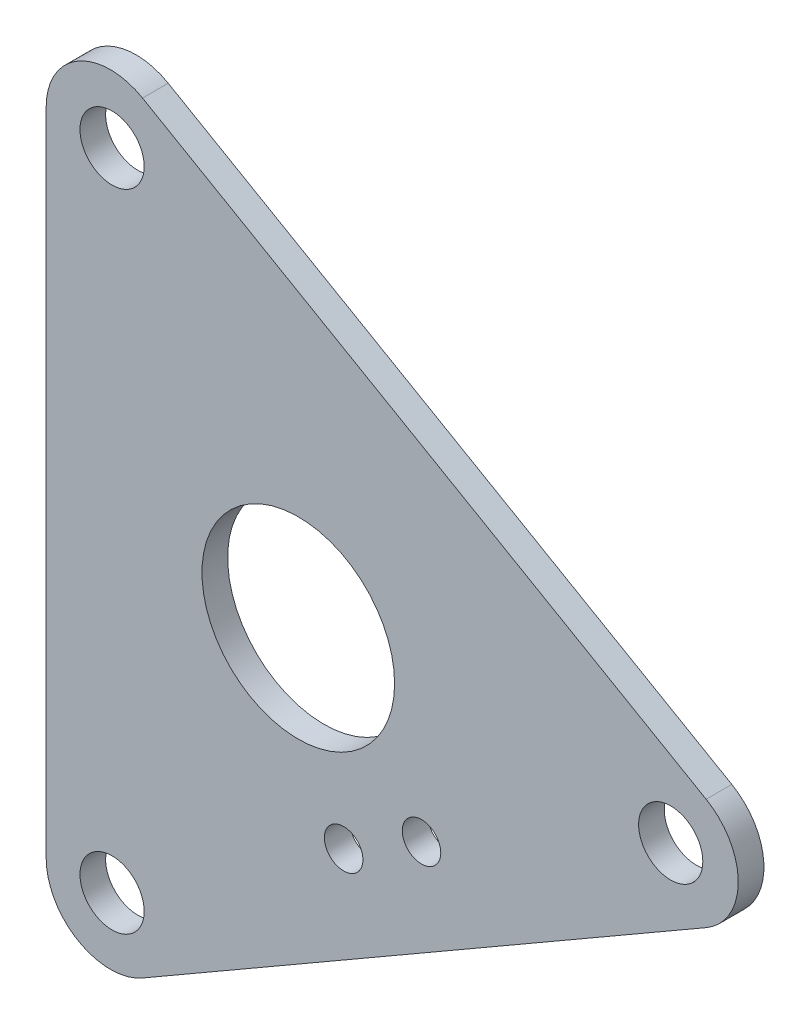
from build123d import *

# Parameters (mm, degrees)
EXTRUDE_1_DEPTH     = 2
SKETCH_2_R          = 7.5
CUT_EXTRUDE_1_DEPTH = 52.974352649
SKETCH_3_R          = 2.5
CUT_EXTRUDE_2_DEPTH = 52.974352649
FILLET_2_R          = 5
SKETCH_4_R          = 1.5
CUT_EXTRUDE_3_DEPTH = 3


with BuildPart() as part:
    # 草图1 → 凸台-拉伸1 (new body)
    with BuildSketch(Plane.XY):
        Polygon((39.259818305, 0), (-19.629909152, 34), (-19.629909152, -34), align=None)
    extrude(amount=EXTRUDE_1_DEPTH)

    # 草图2 → 切除-拉伸1 (cut, through all)
    with BuildSketch(Plane.XY.offset(2)):
        Circle(SKETCH_2_R)
    extrude(amount=-CUT_EXTRUDE_1_DEPTH, mode=Mode.SUBTRACT)

    # 草图3 → 切除-拉伸2 (cut, through all)
    with BuildSketch(Plane.XY.offset(2)):
        with Locations((29, 0)):
            Circle(SKETCH_3_R)
        with Locations((-14.5, -25.11473671)):
            Circle(SKETCH_3_R)
        with Locations((-14.5, 25.11473671)):
            Circle(SKETCH_3_R)
    extrude(amount=-CUT_EXTRUDE_2_DEPTH, mode=Mode.SUBTRACT)

    # 圆角2
    fillet_2_edges = [part.edges().sort_by_distance(p)[0] for p in [
        (-19.629909152, -34, 1),
        (-19.629909152, 34, 1),
        (39.259818305, 0, 1),
    ]]
    fillet(fillet_2_edges, radius=FILLET_2_R)

    # 草图4 → 切除-拉伸3 (cut)
    with BuildSketch(Plane(origin=(0, 0, 0), x_dir=(-1, 0, 0), z_dir=(0, 0, -1))):
        with Locations(Location((-3.533865663, -13.120834875, 0), (0, 0, 180))):
            Circle(SKETCH_4_R)
        with Locations((-9.596043489, -9.620834875)):
            Circle(SKETCH_4_R)
    extrude(amount=-CUT_EXTRUDE_3_DEPTH, mode=Mode.SUBTRACT)


solid = part.part
